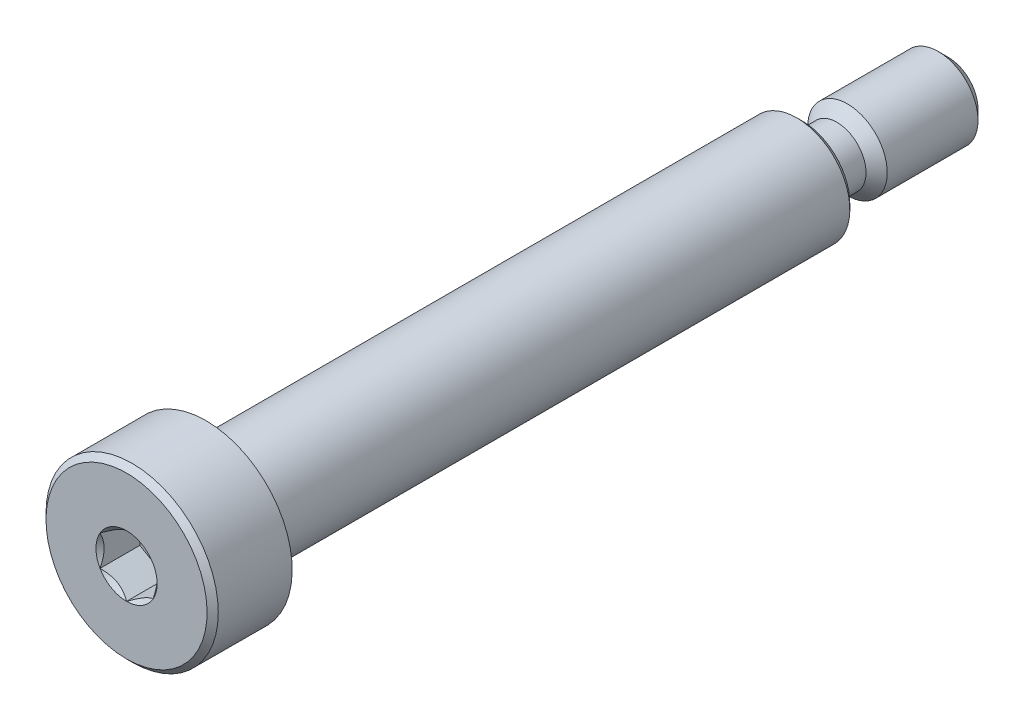
from build123d import *

# Parameters (mm, degrees)
SKETCH12_W         = 0.866666667
SKETCH12_H         = 0.866666667
CHAMFER3_SIZE      = 0.26
CHAMFER1_SIZE      = 0.75
CHAMFER2_SIZE      = 0.4225
CUT_EXTRUDE2_DEPTH = 3


with BuildPart() as part:
    # Sketch1 → Revolve1 (revolve)
    with BuildSketch(Plane(origin=(0, 0, 0), x_dir=(0, 0, -1), z_dir=(1, 0, 0))):
        Polygon((0, 6.5), (6, 6.5), (6, 4), (51, 4), (51, 3), (62, 3), (62, 0), (0, 0), align=None)
    revolve(axis=Axis((0, 0, -62), (0, 0, 1)))

    # Sketch12 → Cut-Revolve2 (revolve, cut)
    with BuildSketch(Plane(origin=(0, 0, 0), x_dir=(0, 0, -1), z_dir=(1, 0, 0))):
        with Locations((6.433333334, 3.566666667)):
            Rectangle(SKETCH12_W, SKETCH12_H)
    revolve(axis=Axis((0, 0, -62), (0, 0, 1)), mode=Mode.SUBTRACT)

    # Chamfer3
    chamfer3_edges = [part.edges().sort_by_distance(p)[0] for p in [
        (0, -4, -6.866666667),
        (0, -3.133333333, -6.866666667),
    ]]
    chamfer(chamfer3_edges, length=CHAMFER3_SIZE)

    # Sketch5 → Cut-Revolve1 (revolve, cut)
    with BuildSketch(Plane(origin=(0, 0, 0), x_dir=(0, 0, -1), z_dir=(1, 0, 0))):
        with BuildLine():
            Line((51, 4), (55.4, 4))
            Line((55.4, 4), (53.6, 2.2))
            Line((53.6, 2.2), (51.8, 2.2))
            ThreePointArc((51.8, 2.2), (51.234314575, 2.434314575), (51, 3))
            Line((51, 3), (51, 4))
        make_face()
    revolve(axis=Axis((0, 0, -62), (0, 0, 1)), mode=Mode.SUBTRACT)

    # Chamfer1
    chamfer1_edges = [part.edges().sort_by_distance(p)[0] for p in [
        (0, -3, -62),
    ]]
    chamfer(chamfer1_edges, length=CHAMFER1_SIZE)

    # Chamfer2
    chamfer2_edges = [part.edges().sort_by_distance(p)[0] for p in [
        (0, -6.5, 0),
        (0, -4, -51),
    ]]
    chamfer(chamfer2_edges, length=CHAMFER2_SIZE)

    # Sketch8 → Cut-Extrude2 (cut)
    with BuildSketch(Plane.XY):
        Polygon((2, 1.154700538), (0, 2.309401077), (-2, 1.154700538), (-2, -1.154700538), (0, -2.309401077), (2, -1.154700538), align=None)
    extrude(amount=-CUT_EXTRUDE2_DEPTH, mode=Mode.SUBTRACT)

    # Cut-Extrude4 cone 1 section (through the dimple's axis) → Cut-Extrude4 (revolve, cut)
    with BuildSketch(Plane(origin=(0, 0, 0), x_dir=(0, -1, 0), z_dir=(1, 0, 0))):
        Polygon((0, 0), (2.309401077, 0), (0, 2.309401077), align=None)
    revolve(axis=Axis((0, 0, 0), (0, 0, -1)), mode=Mode.SUBTRACT)


solid = part.part
